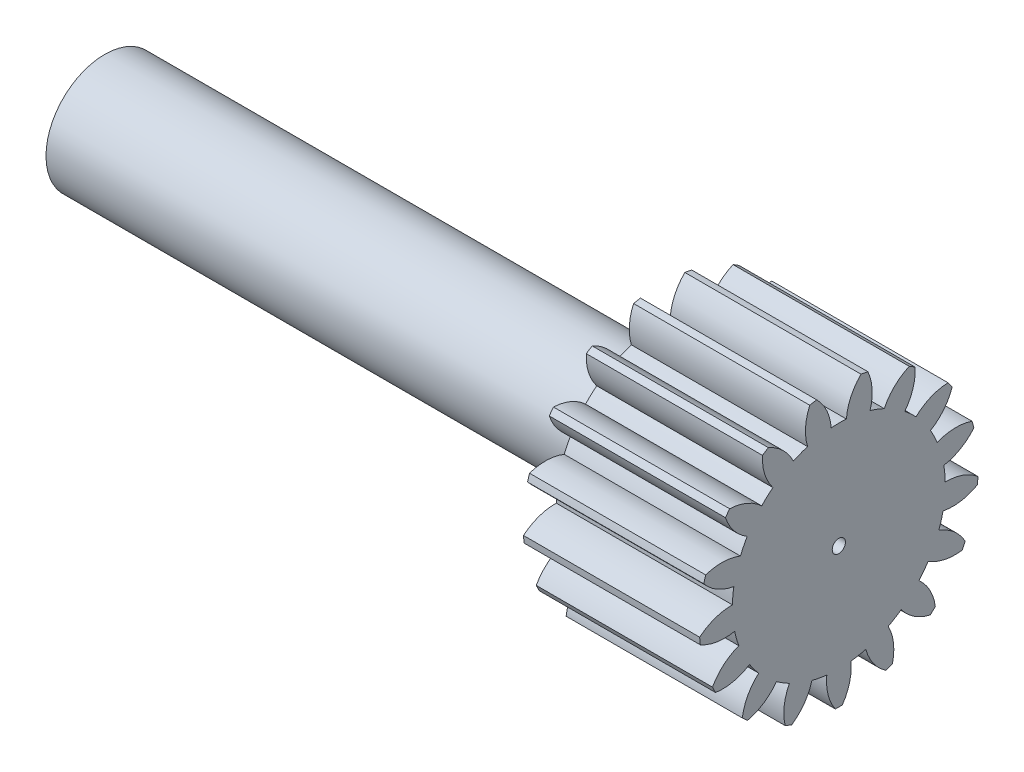
from build123d import *

# Parameters (mm, degrees)
BASPROSKE_W      = 12
BASPROSKE_H      = 9.5
TOOTHCUT_DEPTH   = 19.013883535
TEETHCUTS_COUNT  = 17
TEETHCUTS_ANGLE  = 338.823529412
HUBNEAONESKE_R   = 4
HUBNEARONE_DEPTH = 38.0000508
BORSKE_R         = 0.45
BORE_DEPTH       = 50.0000508


with BuildPart() as part:
    # BasProSke → Base-Revolve (revolve)
    with BuildSketch(Plane(origin=(0, 0, 0), x_dir=(1, 0, 0), z_dir=(0, 1, 0)), mode=Mode.PRIVATE) as base_revolve_sk:
        with Locations((6, 4.75)):
            Rectangle(BASPROSKE_W, BASPROSKE_H)
    revolve(base_revolve_sk.sketch.rotate(Axis((-10, 0, 0), (1, 0, 0)), 180), axis=Axis((-10, 0, 0), (1, 0, 0)))

    # TooCutSke → ToothCut (cut, through all)
    with BuildSketch(Plane(origin=(0, 0, 0), x_dir=(0, 0, -1), z_dir=(1, 0, 0))):
        with BuildLine():
            ThreePointArc((0.516861231, 7.23055015), (0, 7.249), (-0.516861231, 7.23055015))
            ThreePointArc((-0.516861231, 7.23055015), (-0.827352654, 8.408398361), (-1.533069197, 9.401220346))
            ThreePointArc((-1.533069197, 9.401220346), (0, 9.5254), (1.533069197, 9.401220346))
            ThreePointArc((1.533069197, 9.401220346), (0.827352654, 8.408398361), (0.516861231, 7.23055015))
        make_face()
    toothcut = extrude(amount=TOOTHCUT_DEPTH, mode=Mode.SUBTRACT)

    # TeethCuts: ToothCut ×17 about axis
    teethcuts_axis = Axis((-10, 0, 0), (1, 0, 0))
    for i in range(1, TEETHCUTS_COUNT):
        add(toothcut.rotate(teethcuts_axis, i * TEETHCUTS_ANGLE / (TEETHCUTS_COUNT - 1)), mode=Mode.SUBTRACT)

    # HubNeaOneSke → HubNearOne (add)
    with BuildSketch(Plane.ZY):
        with Locations(Location((0, 0, 0), (0, 0, 180))):
            Circle(HUBNEAONESKE_R)
    extrude(amount=HUBNEARONE_DEPTH)

    # BorSke → Bore (cut, symmetric)
    with BuildSketch(Plane(origin=(0, 0, 0), x_dir=(0, 0, -1), z_dir=(1, 0, 0))):
        with Locations(Location((0, 0, 0), (0, 0, 180))):
            Circle(BORSKE_R)
    extrude(amount=BORE_DEPTH, both=True, mode=Mode.SUBTRACT)


solid = part.part
